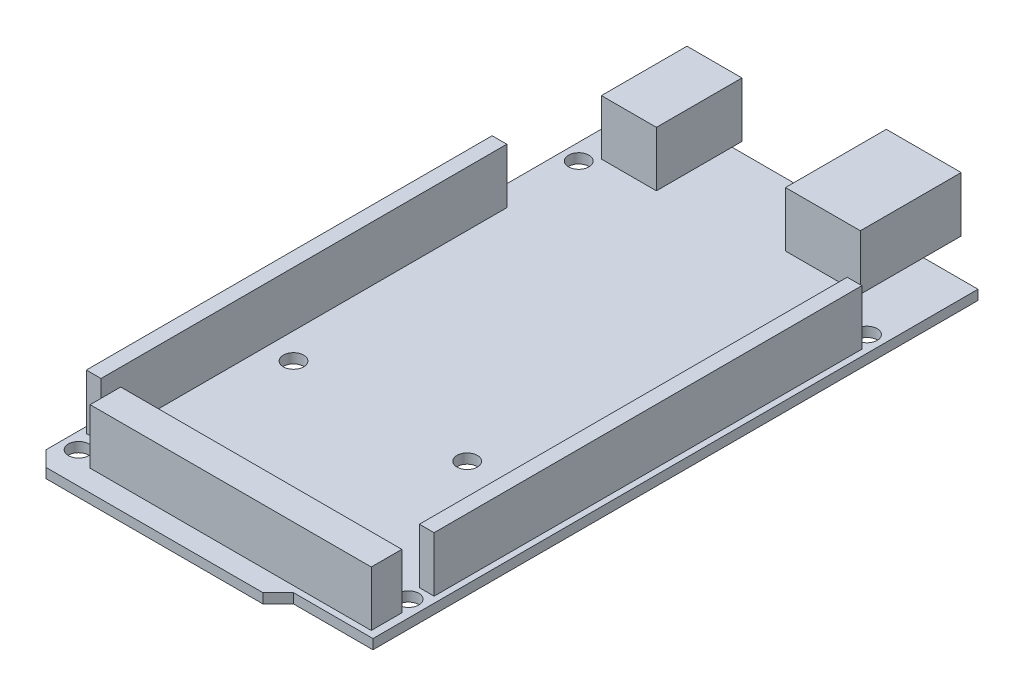
from build123d import *

# Parameters (mm, degrees)
SKETCH1_W           = 53.5
SKETCH1_H           = 99
SKETCH1_R           = 1.666666667
BOSS_EXTRUDE1_DEPTH = 1.6
SKETCH2_W           = 46
SKETCH2_H           = 5
SKETCH2_W_2         = 2.4
SKETCH2_H_2         = 66.4
SKETCH2_H_3         = 70
SKETCH2_W_3         = 9
SKETCH2_H_4         = 14
SKETCH2_W_4         = 12.25
SKETCH2_H_5         = 16.5
BOSS_EXTRUDE2_DEPTH = 9


with BuildPart() as part:
    # Sketch1 → Boss-Extrude1 (new body)
    # profile 1 of 2: a face of its own
    with BuildSketch(Plane(origin=(0, 0, 0), x_dir=(1, 0, 0), z_dir=(0, 1, 0))):
        with Locations((26.75, 49.5)):
            Rectangle(SKETCH1_W, SKETCH1_H)
        with Locations(Location((50.833333333, 8.5, 0), (0, 0, 270))):
            Circle(SKETCH1_R, mode=Mode.SUBTRACT)
        with Locations(Location((2.666666667, 2.666666667, 0), (0, 0, 270))):
            Circle(SKETCH1_R, mode=Mode.SUBTRACT)
        with Locations(Location((36.083333333, 32.833333333, 0), (0, 0, 270))):
            Circle(SKETCH1_R, mode=Mode.SUBTRACT)
        with Locations(Location((7.666666667, 32.833333333, 0), (0, 0, 270))):
            Circle(SKETCH1_R, mode=Mode.SUBTRACT)
        with Locations(Location((50.833333333, 83.5, 0), (0, 0, 270))):
            Circle(SKETCH1_R, mode=Mode.SUBTRACT)
        with Locations(Location((2.666666667, 84.5, 0), (0, 0, 270))):
            Circle(SKETCH1_R, mode=Mode.SUBTRACT)
    # profile 2 of 2: a face of its own
    with BuildSketch(Plane(origin=(0, 0, 0), x_dir=(1, 0, 0), z_dir=(0, 1, 0))):
        Polygon((0, 0), (2.5, -2.5), (38, -2.5), (40.5, 0), align=None)
    extrude(amount=BOSS_EXTRUDE1_DEPTH)

    # Sketch2 → Boss-Extrude2 (add)
    with BuildSketch(Plane(origin=(0, 1.6, 0), x_dir=(1, 0, 0), z_dir=(0, 1, 0))):
        with Locations((29.22, 3.5)):
            Rectangle(SKETCH2_W, SKETCH2_H)
        with Locations((2.2, 38.8)):
            Rectangle(SKETCH2_W_2, SKETCH2_H_2)
        with Locations((51.3, 46)):
            Rectangle(SKETCH2_W_2, SKETCH2_H_3)
        with Locations((8.75, 93.63)):
            Rectangle(SKETCH2_W_3, SKETCH2_H_4)
        with Locations((38.465, 96.91)):
            Rectangle(SKETCH2_W_4, SKETCH2_H_5)
    extrude(amount=BOSS_EXTRUDE2_DEPTH)


solid = part.part
